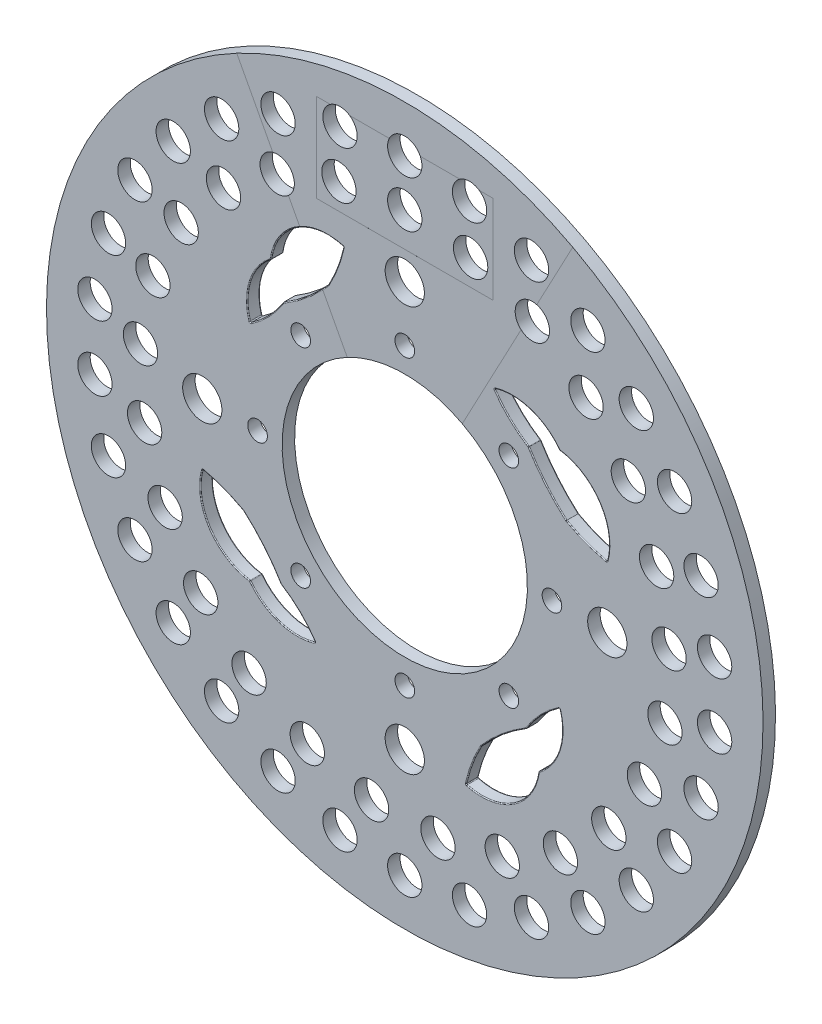
from build123d import *

# Parameters (mm, degrees)
SKETCH1_W               = 72
SKETCH1_H               = 36
BOSS_EXTRUDE1_DEPTH     = 2.539873
SKETCH2_W               = 72.8
SKETCH2_H               = 36.83
BOSS_EXTRUDE2_DEPTH     = 2.53873
BOSS_EXTRUDE4_DEPTH     = 2.54
CUT_EXTRUDE1_DEPTH      = 207.561508031
CUT_EXTRUDE1_DEPTH_BACK = 207.561508031
SKETCH4_R               = 7
CUT_EXTRUDE2_DEPTH      = 207.561508031
CUT_EXTRUDE2_DEPTH_BACK = 207.561508031
SKETCH5_R               = 7
CUT_EXTRUDE3_DEPTH      = 207.561508031
CUT_EXTRUDE3_DEPTH_BACK = 207.561508031
SKETCH6_R               = 8
CUT_EXTRUDE4_DEPTH      = 207.561508031
CUT_EXTRUDE4_DEPTH_BACK = 207.561508031
SKETCH7_R               = 50
CUT_EXTRUDE5_DEPTH      = 207.561508031
CUT_EXTRUDE5_DEPTH_BACK = 207.561508031
SKETCH8_R               = 4
CUT_EXTRUDE6_DEPTH      = 207.561508031
CUT_EXTRUDE6_DEPTH_BACK = 207.561508031
FILLET1_R               = 0.35


with BuildPart() as part:
    # Sketch1 → Boss-Extrude1 (new, symmetric)
    with BuildSketch(Plane.XY):
        with BuildLine():
            Line((-68.480672456, 129), (0, 0))
            Line((0, 0), (68.480672456, 129))
            ThreePointArc((68.480672456, 129), (0, 146.05), (-68.480672456, 129))
        make_face()
        with Locations((0, 112)):
            Rectangle(SKETCH1_W, SKETCH1_H, mode=Mode.SUBTRACT)
    extrude(amount=BOSS_EXTRUDE1_DEPTH, both=True)

    # Sketch2 → Boss-Extrude2 (add, symmetric)
    with BuildSketch(Plane.XY):
        with Locations((0, 111.585)):
            Rectangle(SKETCH2_W, SKETCH2_H)
    extrude(amount=BOSS_EXTRUDE2_DEPTH, both=True)

    # Sketch3 → Boss-Extrude4 (add, symmetric)
    with BuildSketch(Plane.XY):
        with BuildLine():
            Line((0, 0), (-68.480672456, 129))
            ThreePointArc((-68.480672456, 129), (0, -146.05), (68.480672456, 129))
            Line((68.480672456, 129), (0, 0))
        make_face()
    extrude(amount=BOSS_EXTRUDE4_DEPTH, both=True)

    # Sketch4 → Cut-Extrude1 (cut, two sides: drawn at the far end of the back side and taken through both)
    with BuildSketch(Plane.XY.offset(-CUT_EXTRUDE1_DEPTH_BACK)):
        with Locations(Location((0, 127, 0), (0, 0, 25.376933525))):
            Circle(SKETCH4_R)
        with Locations(Location((26.404784734, 124.224745293, 0), (0, 0, 55.592180555))):
            Circle(SKETCH4_R)
        with Locations((51.655553671, 116.020273121)):
            Circle(SKETCH4_R)
        with Locations((74.648727041, 102.745158286)):
            Circle(SKETCH4_R)
        with Locations((94.379392836, 84.979587008)):
            Circle(SKETCH4_R)
        with Locations((109.985226281, 63.5)):
            Circle(SKETCH4_R)
        with Locations((120.784177569, 39.245158286)):
            Circle(SKETCH4_R)
        with Locations((126.304280712, 13.275114835)):
            Circle(SKETCH4_R)
        with Locations((126.304280712, -13.275114835)):
            Circle(SKETCH4_R)
        with Locations((120.784177569, -39.245158286)):
            Circle(SKETCH4_R)
        with Locations((109.985226281, -63.5)):
            Circle(SKETCH4_R)
        with Locations((94.379392836, -84.979587008)):
            Circle(SKETCH4_R)
        with Locations((74.648727041, -102.745158286)):
            Circle(SKETCH4_R)
        with Locations((51.655553671, -116.020273121)):
            Circle(SKETCH4_R)
        with Locations((26.404784734, -124.224745293)):
            Circle(SKETCH4_R)
        with Locations((0, -127)):
            Circle(SKETCH4_R)
        with Locations((-26.404784734, -124.224745293)):
            Circle(SKETCH4_R)
        with Locations((-51.655553671, -116.020273121)):
            Circle(SKETCH4_R)
        with Locations((-74.648727041, -102.745158286)):
            Circle(SKETCH4_R)
        with Locations((-94.379392836, -84.979587008)):
            Circle(SKETCH4_R)
        with Locations((-109.985226281, -63.5)):
            Circle(SKETCH4_R)
        with Locations((-120.784177569, -39.245158286)):
            Circle(SKETCH4_R)
        with Locations((-126.304280712, -13.275114835)):
            Circle(SKETCH4_R)
        with Locations((-126.304280712, 13.275114835)):
            Circle(SKETCH4_R)
        with Locations((-120.784177569, 39.245158286)):
            Circle(SKETCH4_R)
        with Locations((-109.985226281, 63.5)):
            Circle(SKETCH4_R)
        with Locations((-94.379392836, 84.979587008)):
            Circle(SKETCH4_R)
        with Locations((-74.648727041, 102.745158286)):
            Circle(SKETCH4_R)
        with Locations((-51.655553671, 116.020273121)):
            Circle(SKETCH4_R)
        with Locations(Location((-26.404784734, 124.224745293, 0), (0, 0, 55.592180555))):
            Circle(SKETCH4_R)
    extrude(amount=CUT_EXTRUDE1_DEPTH + CUT_EXTRUDE1_DEPTH_BACK, mode=Mode.SUBTRACT)

    # Sketch5 → Cut-Extrude2 (cut, two sides: drawn at the far end of the back side and taken through both)
    with BuildSketch(Plane.XY.offset(-CUT_EXTRUDE2_DEPTH_BACK)):
        with Locations((0, 107.95)):
            Circle(SKETCH5_R)
        with Locations((26.846073319, 104.558552244)):
            Circle(SKETCH5_R)
        with Locations(Location((52.005309119, 94.597306111, 0), (0, 0, 75.073655725))):
            Circle(SKETCH5_R)
        with Locations((73.896860085, 78.69216333)):
            Circle(SKETCH5_R)
        with Locations((91.145199558, 57.842502518)):
            Circle(SKETCH5_R)
        with Locations((102.666550934, 33.358384543)):
            Circle(SKETCH5_R)
        with Locations((107.736985334, 6.778236583)):
            Circle(SKETCH5_R)
        with Locations((106.037908716, -20.22781291)):
            Circle(SKETCH5_R)
        with Locations((97.676080314, -45.962874524)):
            Circle(SKETCH5_R)
        with Locations((83.176904558, -68.809919693)):
            Circle(SKETCH5_R)
        with Locations((63.451417985, -87.333384543)):
            Circle(SKETCH5_R)
        with Locations((39.739045462, -100.369371652)):
            Circle(SKETCH5_R)
        with Locations((13.529722563, -107.098782007)):
            Circle(SKETCH5_R)
        with Locations((-13.529722563, -107.098782007)):
            Circle(SKETCH5_R)
        with Locations((-39.739045462, -100.369371652)):
            Circle(SKETCH5_R)
        with Locations((-63.451417985, -87.333384543)):
            Circle(SKETCH5_R)
        with Locations((-83.176904558, -68.809919693)):
            Circle(SKETCH5_R)
        with Locations((-97.676080314, -45.962874524)):
            Circle(SKETCH5_R)
        with Locations((-106.037908716, -20.22781291)):
            Circle(SKETCH5_R)
        with Locations((-107.736985334, 6.778236583)):
            Circle(SKETCH5_R)
        with Locations((-102.666550934, 33.358384543)):
            Circle(SKETCH5_R)
        with Locations((-91.145199558, 57.842502518)):
            Circle(SKETCH5_R)
        with Locations((-73.896860085, 78.69216333)):
            Circle(SKETCH5_R)
        with Locations(Location((-52.005309119, 94.597306111, 0), (0, 0, 310.997559473))):
            Circle(SKETCH5_R)
        with Locations((-26.846073319, 104.558552244)):
            Circle(SKETCH5_R)
    extrude(amount=CUT_EXTRUDE2_DEPTH + CUT_EXTRUDE2_DEPTH_BACK, mode=Mode.SUBTRACT)

    # Sketch6 → Cut-Extrude3 (cut, two sides: drawn at the far end of the back side and taken through both)
    with BuildSketch(Plane.XY.offset(-CUT_EXTRUDE3_DEPTH_BACK)):
        with Locations((-82.55, 0)):
            Circle(SKETCH6_R)
        with Locations((0, 82.55)):
            Circle(SKETCH6_R)
        with Locations((82.55, 0)):
            Circle(SKETCH6_R)
        with Locations((0, -82.55)):
            Circle(SKETCH6_R)
    extrude(amount=CUT_EXTRUDE3_DEPTH + CUT_EXTRUDE3_DEPTH_BACK, mode=Mode.SUBTRACT)

    # Sketch7 → Cut-Extrude4 (cut, two sides: drawn at the far end of the back side and taken through both)
    with BuildSketch(Plane.XY.offset(-CUT_EXTRUDE4_DEPTH_BACK)):
        with Locations(Location((0, 0, 0), (0, 0, 62.038048126))):
            Circle(SKETCH7_R)
    extrude(amount=CUT_EXTRUDE4_DEPTH + CUT_EXTRUDE4_DEPTH_BACK, mode=Mode.SUBTRACT)

    # Sketch8 → Cut-Extrude5 (cut, two sides: drawn at the far end of the back side and taken through both)
    with BuildSketch(Plane.XY.offset(-CUT_EXTRUDE5_DEPTH_BACK)):
        with Locations((0, 60)):
            Circle(SKETCH8_R)
        with Locations((42.426406871, 42.426406871)):
            Circle(SKETCH8_R)
        with Locations((60, 0)):
            Circle(SKETCH8_R)
        with Locations((42.426406871, -42.426406871)):
            Circle(SKETCH8_R)
        with Locations((0, -60)):
            Circle(SKETCH8_R)
        with Locations((-42.426406871, -42.426406871)):
            Circle(SKETCH8_R)
        with Locations((-60, 0)):
            Circle(SKETCH8_R)
        with Locations((-42.426406871, 42.426406871)):
            Circle(SKETCH8_R)
    extrude(amount=CUT_EXTRUDE5_DEPTH + CUT_EXTRUDE5_DEPTH_BACK, mode=Mode.SUBTRACT)

    # Sketch9 → Cut-Extrude6 (cut, two sides: drawn at the far end of the back side and taken through both)
    with BuildSketch(Plane.XY.offset(-CUT_EXTRUDE6_DEPTH_BACK)):
        with BuildLine():
            ThreePointArc((36.481122147, 63.083820358), (51.138482372, 63.048379825), (63.083820358, 54.554360446))
            ThreePointArc((63.083820358, 54.554360446), (79.485358342, 44.144677948), (82.432097918, 24.943410702))
            ThreePointArc((82.432097918, 24.943410702), (73.923751742, 27.469956829), (65.863065172, 31.184889132))
            ThreePointArc((65.863065172, 31.184889132), (57.480456545, 39.75640872), (50.514792199, 49.514410343))
            ThreePointArc((50.514792199, 49.514410343), (42.776659651, 55.553139554), (36.481122147, 63.083820358))
        make_face()
        with BuildLine():
            ThreePointArc((31.184889132, -65.863065172), (27.469956829, -73.923751742), (24.943410702, -82.432097918))
            ThreePointArc((24.943410702, -82.432097918), (44.144677948, -79.485358342), (54.554360446, -63.083820358))
            ThreePointArc((54.554360446, -63.083820358), (63.048379825, -51.138482372), (63.083820358, -36.481122147))
            ThreePointArc((63.083820358, -36.481122147), (55.553139554, -42.776659651), (49.514410343, -50.514792199))
            ThreePointArc((49.514410343, -50.514792199), (39.75640872, -57.480456545), (31.184889132, -65.863065172))
        make_face()
        with BuildLine():
            ThreePointArc((-65.863065172, -31.184889132), (-73.923751742, -27.469956829), (-82.432097918, -24.943410702))
            ThreePointArc((-82.432097918, -24.943410702), (-79.485358342, -44.144677948), (-63.083820358, -54.554360446))
            ThreePointArc((-63.083820358, -54.554360446), (-51.138482372, -63.048379825), (-36.481122147, -63.083820358))
            ThreePointArc((-36.481122147, -63.083820358), (-42.776659651, -55.553139554), (-50.514792199, -49.514410343))
            ThreePointArc((-50.514792199, -49.514410343), (-57.480456545, -39.75640872), (-65.863065172, -31.184889132))
        make_face()
        with BuildLine():
            ThreePointArc((-31.184889132, 65.863065172), (-27.469956829, 73.923751742), (-24.943410702, 82.432097918))
            ThreePointArc((-24.943410702, 82.432097918), (-44.144677948, 79.485358342), (-54.554360446, 63.083820358))
            ThreePointArc((-54.554360446, 63.083820358), (-63.048379825, 51.138482372), (-63.083820358, 36.481122147))
            ThreePointArc((-63.083820358, 36.481122147), (-55.553139554, 42.776659651), (-49.514410343, 50.514792199))
            ThreePointArc((-49.514410343, 50.514792199), (-39.75640872, 57.480456545), (-31.184889132, 65.863065172))
        make_face()
    extrude(amount=CUT_EXTRUDE6_DEPTH + CUT_EXTRUDE6_DEPTH_BACK, mode=Mode.SUBTRACT)

    # Fillet1
    fillet1_edges = [part.edges().sort_by_distance(p)[0] for p in [
        (-50.649978759, 73.131039311, -2.54),
        (-27.469956829, 73.923751742, -2.539873),
        (-50.649978759, 73.131039311, 2.54),
        (-63.048379825, 51.138482372, 2.54),
        (-55.553139554, 42.776659651, 2.54),
        (-41.126920877, 56.359146304, 2.54),
        (-27.469956829, 73.923751742, 2.539873),
        (-24.943410702, 82.432097918, 0),
        (-42.667631383, 80.374859811, 2.5399365),
        (-34.008560318, 83.152772207, -2.539873),
        (-42.667631383, 80.374859811, -2.5399365),
        (-54.554360446, 63.083820358, 0),
        (-34.008560318, 83.152772207, 2.539873),
        (-33.578394084, 63.253070998, 2.5399365),
        (-41.126920877, 56.359146304, -2.54),
        (-33.578394084, 63.253070998, -2.5399365),
        (-32.366784946, 64.544443728, -2.539873),
        (-31.184889132, 65.863065172, 0),
        (-32.366784946, 64.544443728, 2.539873),
        (-49.514410343, 50.514792199, 0),
        (-55.553139554, 42.776659651, -2.54),
        (-63.083820358, 36.481122147, 0),
        (-63.048379825, 51.138482372, -2.54),
        (-63.083820358, -54.554360446, 0),
        (-79.485358342, -44.144677948, -2.54),
        (-82.432097918, -24.943410702, 0),
        (-73.923751742, -27.469956829, -2.54),
        (-65.863065172, -31.184889132, 0),
        (-57.480456545, -39.75640872, -2.54),
        (-50.514792199, -49.514410343, 0),
        (-42.776659651, -55.553139554, -2.54),
        (-36.481122147, -63.083820358, 0),
        (-51.138482372, -63.048379825, -2.54),
        (-79.485358342, -44.144677948, 2.54),
        (-51.138482372, -63.048379825, 2.54),
        (-42.776659651, -55.553139554, 2.54),
        (-57.480456545, -39.75640872, 2.54),
        (-73.923751742, -27.469956829, 2.54),
        (54.554360446, -63.083820358, 0),
        (44.144677948, -79.485358342, -2.54),
        (24.943410702, -82.432097918, 0),
        (27.469956829, -73.923751742, -2.54),
        (31.184889132, -65.863065172, 0),
        (39.75640872, -57.480456545, -2.54),
        (49.514410343, -50.514792199, 0),
        (55.553139554, -42.776659651, -2.54),
        (63.083820358, -36.481122147, 0),
        (63.048379825, -51.138482372, -2.54),
        (44.144677948, -79.485358342, 2.54),
        (63.048379825, -51.138482372, 2.54),
        (55.553139554, -42.776659651, 2.54),
        (39.75640872, -57.480456545, 2.54),
        (27.469956829, -73.923751742, 2.54),
        (82.432097918, 24.943410702, 0),
        (73.923751742, 27.469956829, -2.54),
        (65.863065172, 31.184889132, 0),
        (57.480456545, 39.75640872, -2.54),
        (50.514792199, 49.514410343, 0),
        (42.776659651, 55.553139554, -2.54),
        (36.481122147, 63.083820358, 0),
        (51.138482372, 63.048379825, -2.54),
        (63.083820358, 54.554360446, 0),
        (79.485358342, 44.144677948, -2.54),
        (73.923751742, 27.469956829, 2.54),
        (79.485358342, 44.144677948, 2.54),
        (51.138482372, 63.048379825, 2.54),
        (42.776659651, 55.553139554, 2.54),
        (57.480456545, 39.75640872, 2.54),
    ]]
    fillet(fillet1_edges, radius=FILLET1_R)


solid = part.part
